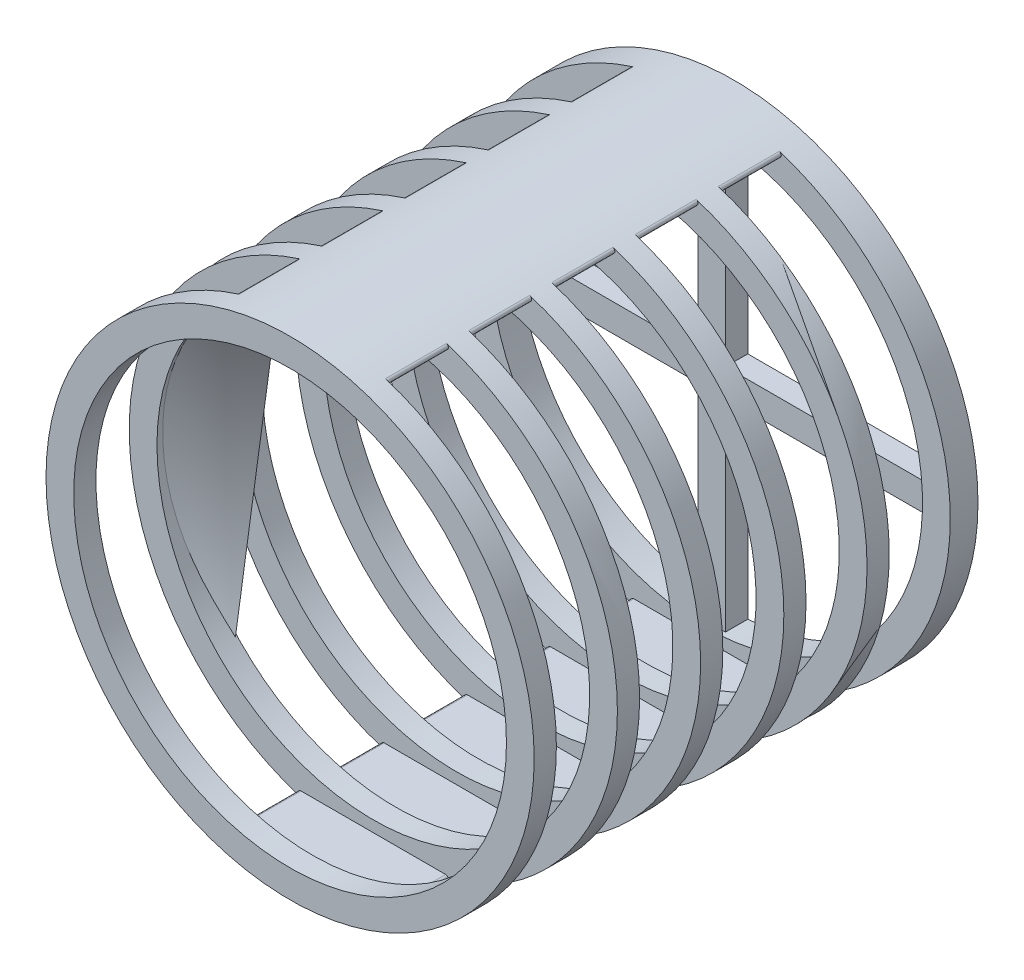
from build123d import *

# Parameters (mm, degrees)
ESQUISSE2_R                  = 44
ESQUISSE2_R_2                = 39
BOSS_EXTRU_1_DEPTH           = 80
BOSS_EXTRU_2_DEPTH           = 4
ENL_V_MAT_EXTRU_1_DEPTH      = 102.350875675
ENL_V_MAT_EXTRU_1_DEPTH_BACK = 102.350875675
ESQUISSE4_W                  = 11
ESQUISSE4_H                  = 82
CONG_1_R                     = 0.5


with BuildPart() as part:
    # Esquisse2 → Boss.-Extru.1 (new body)
    with BuildSketch(Plane.XY):
        Circle(ESQUISSE2_R)
        Circle(ESQUISSE2_R_2, mode=Mode.SUBTRACT)
    extrude(amount=BOSS_EXTRU_1_DEPTH)

    # Esquisse3 → Boss.-Extru.2 (add)
    with BuildSketch(Plane(origin=(0, 0, 0), x_dir=(-1, 0, 0), z_dir=(0, 0, -1))):
        Polygon((-2.5, 2.5), (-42, 2.5), (-42, -2.5), (-2.5, -2.5), (-2.5, -42), (2.5, -42), (2.5, -2.5), (42, -2.5), (42, 2.5), (2.5, 2.5), (2.5, 42), (-2.5, 42), align=None)
    extrude(amount=-BOSS_EXTRU_2_DEPTH)

    # Esquisse4 → Enlèv. mat.-Extru.1 (cut, two sides: drawn at the far end of the back side and taken through both)
    with BuildSketch(Plane(origin=(0, 0, 0), x_dir=(0, 0, -1), z_dir=(1, 0, 0)).offset(-ENL_V_MAT_EXTRU_1_DEPTH_BACK)):
        with Locations((-10.5, 0)):
            Rectangle(ESQUISSE4_W, ESQUISSE4_H)
        with Locations((-25.5, 0)):
            Rectangle(ESQUISSE4_W, ESQUISSE4_H)
        with Locations((-40.5, 0)):
            Rectangle(ESQUISSE4_W, ESQUISSE4_H)
        with Locations((-55.5, 0)):
            Rectangle(ESQUISSE4_W, ESQUISSE4_H)
        with Locations((-70.5, 0)):
            Rectangle(ESQUISSE4_W, ESQUISSE4_H)
    extrude(amount=ENL_V_MAT_EXTRU_1_DEPTH + ENL_V_MAT_EXTRU_1_DEPTH_BACK, mode=Mode.SUBTRACT)

    # Congé1
    cong_1_edges = [part.edges().sort_by_distance(p)[0] for p in [
        (15.968719423, 41, 10.5),
        (-15.968719423, 41, 10.5),
        (15.968719423, -41, 70.5),
        (-15.968719423, -41, 70.5),
        (15.968719423, 41, 70.5),
        (-15.968719423, 41, 70.5),
        (15.968719423, -41, 55.5),
        (-15.968719423, -41, 55.5),
        (15.968719423, 41, 55.5),
        (-15.968719423, 41, 55.5),
        (15.968719423, -41, 40.5),
        (-15.968719423, -41, 40.5),
        (15.968719423, 41, 40.5),
        (-15.968719423, 41, 40.5),
        (15.968719423, -41, 25.5),
        (-15.968719423, -41, 25.5),
        (15.968719423, 41, 25.5),
        (-15.968719423, 41, 25.5),
        (15.968719423, -41, 10.5),
        (-15.968719423, -41, 10.5),
    ]]
    fillet(cong_1_edges, radius=CONG_1_R)


solid = part.part
